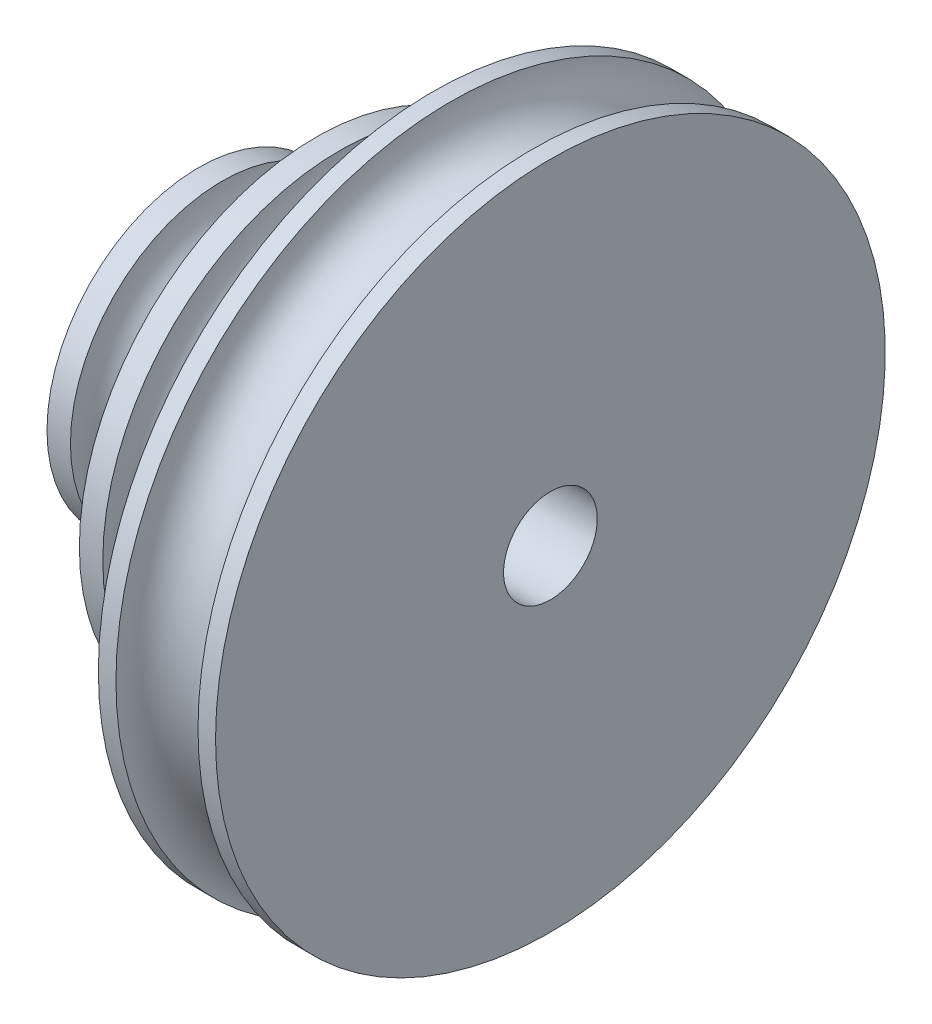
from build123d import *


with BuildPart() as part:
    # 草图1 → 旋转1 (revolve)
    with BuildSketch(Plane.XY, mode=Mode.PRIVATE) as revolve_1_sk:
        Polygon((-30.994158341, 24.942841616), (-30.994158341, 33.895222569), (-20.994158341, 33.895222569), (-20.994158341, 41.133317807), (-10.994158341, 41.133317807), (-10.994158341, 49.514270188), (-0.994158341, 49.514270188), (-0.994158341, 24.942841616), align=None)
    revolve(revolve_1_sk.sketch.rotate(Axis((-56.898920246, 20.942841616, 0), (1, 0, 0)), 90), axis=Axis((-56.898920246, 20.942841616, 0), (1, 0, 0)))

    # 草图2 → 切除-旋转1 (revolve, cut)
    with BuildSketch(Plane.XY, mode=Mode.PRIVATE) as cut_revolve_1_sk:
        with BuildLine():
            Line((-28.994158341, 33.895222569), (-20.994158341, 33.895222569))
            ThreePointArc((-20.994158341, 33.895222569), (-24.994158341, 29.895222569), (-28.994158341, 33.895222569))
        make_face()
        with BuildLine():
            Line((-18.994158341, 41.133317807), (-10.994158341, 41.133317807))
            ThreePointArc((-10.994158341, 41.133317807), (-14.994158341, 37.133317807), (-18.994158341, 41.133317807))
        make_face()
        with BuildLine():
            Line((-9.494158341, 49.514270188), (-2.494158341, 49.514270188))
            ThreePointArc((-2.494158341, 49.514270188), (-5.994158341, 46.014270188), (-9.494158341, 49.514270188))
        make_face()
    revolve(cut_revolve_1_sk.sketch.rotate(Axis((-38.589359974, 20.942841616, 0), (1, 0, 0)), 90), axis=Axis((-38.589359974, 20.942841616, 0), (1, 0, 0)), mode=Mode.SUBTRACT)


solid = part.part
